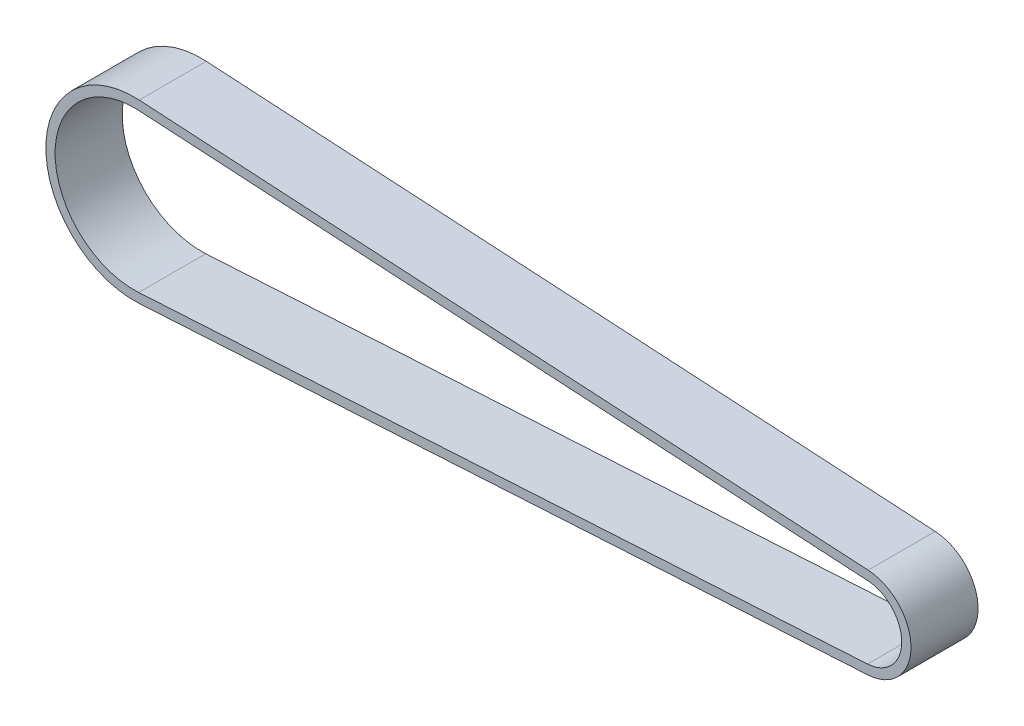
from build123d import *

# Parameters (mm, degrees)
EXTRUDE_1_DEPTH = 10


with BuildPart() as part:
    # Эскиз1 → Бобышка-Вытянуть1 (new body)
    with BuildSketch(Plane.XY):
        with BuildLine():
            Line((0.767985359, 13.126753564), (109.396164528, 6.771423527))
            ThreePointArc((109.396164528, 6.771423527), (115.7830025, 0), (109.396164528, -6.771423527))
            Line((109.396164528, -6.771423527), (0.767985359, -13.126753564))
            ThreePointArc((0.767985359, -13.126753564), (-13.1492, 0), (0.767985359, 13.126753564))
        make_face()
        with BuildLine():
            Line((109.315564963, -5.393779266), (0.687385795, -11.749109303))
            ThreePointArc((0.687385795, -11.749109303), (-11.7692, 0), (0.687385795, 11.749109303))
            Line((0.687385795, 11.749109303), (109.315564963, 5.393779266))
            ThreePointArc((109.315564963, 5.393779266), (114.4030025, 0), (109.315564963, -5.393779266))
        make_face(mode=Mode.SUBTRACT)
    extrude(amount=-EXTRUDE_1_DEPTH)


solid = part.part
